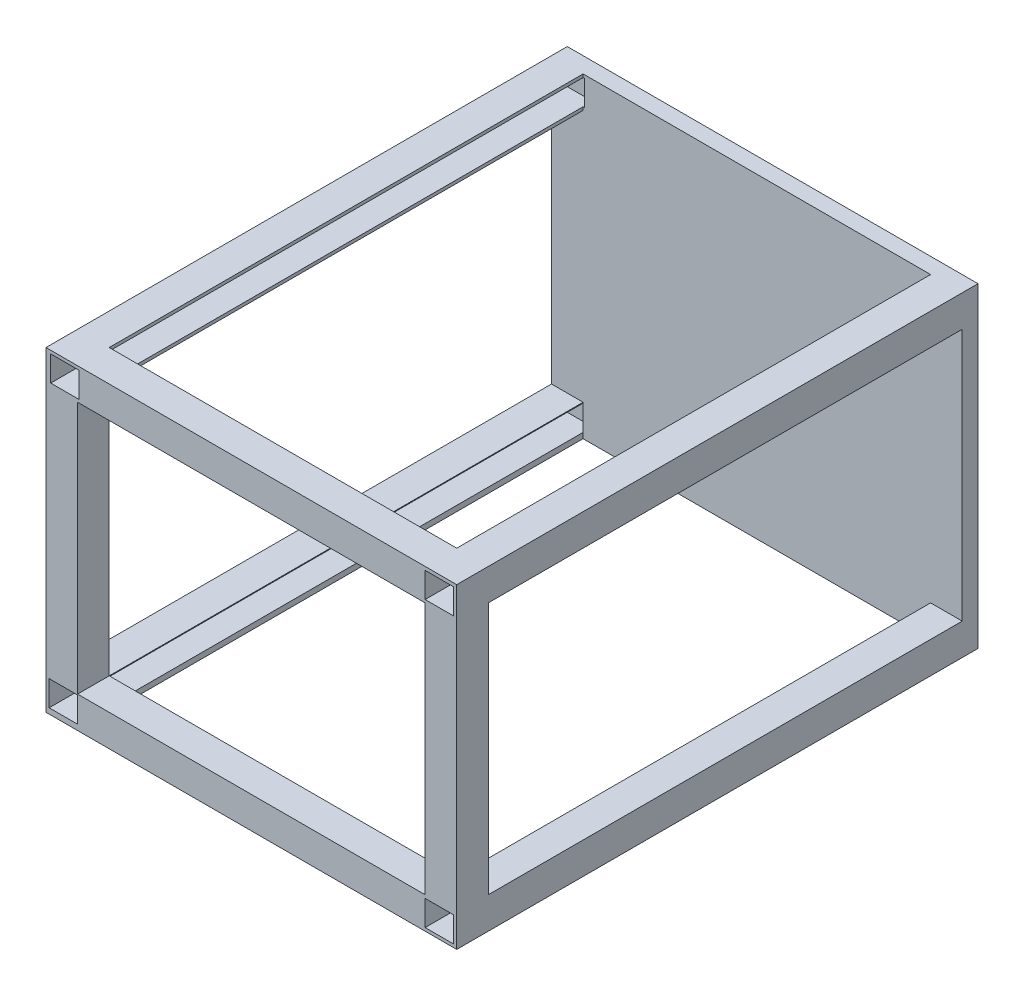
from build123d import *

# Parameters (mm, degrees)
SKETCH1_W           = 130
SKETCH1_H           = 100
BOSS_EXTRUDE1_DEPTH = 5
SKETCH2_W           = 10
SKETCH2_H           = 10
BOSS_EXTRUDE2_DEPTH = 160
SKETCH3_W           = 10
SKETCH3_H           = 10
BOSS_EXTRUDE3_DEPTH = 110
SKETCH4_W           = 10
SKETCH4_H           = 10
BOSS_EXTRUDE4_DEPTH = 110
SKETCH5_W           = 10
SKETCH5_H           = 10
BOSS_EXTRUDE5_DEPTH = 80
SKETCH6_W           = 10
SKETCH6_H           = 10
BOSS_EXTRUDE6_DEPTH = 80
SKETCH9_W           = 9
SKETCH9_H           = 8
CUT_EXTRUDE4_DEPTH  = 163


with BuildPart() as part:
    # Sketch1 → Boss-Extrude1 (new body)
    with BuildSketch(Plane.XY):
        with Locations((65, 50)):
            Rectangle(SKETCH1_W, SKETCH1_H)
    extrude(amount=BOSS_EXTRUDE1_DEPTH)

    # Sketch2 → Boss-Extrude2 (add)
    with BuildSketch(Plane.XY.offset(5)):
        with Locations((5, 95)):
            Rectangle(SKETCH2_W, SKETCH2_H)
        with Locations((125, 95)):
            Rectangle(SKETCH2_W, SKETCH2_H)
        with Locations((5, 5)):
            Rectangle(SKETCH2_W, SKETCH2_H)
        with Locations((125, 5)):
            Rectangle(SKETCH2_W, SKETCH2_H)
    extrude(amount=BOSS_EXTRUDE2_DEPTH)

    # Sketch3 → Boss-Extrude3 (add)
    with BuildSketch(Plane(origin=(10, 0, 0), x_dir=(0, 0, -1), z_dir=(1, 0, 0))):
        with Locations((-160, 5)):
            Rectangle(SKETCH3_W, SKETCH3_H)
    extrude(amount=BOSS_EXTRUDE3_DEPTH)

    # Sketch4 → Boss-Extrude4 (add)
    with BuildSketch(Plane(origin=(10, 0, 0), x_dir=(0, 0, -1), z_dir=(1, 0, 0))):
        with Locations((-160, 95)):
            Rectangle(SKETCH4_W, SKETCH4_H)
    extrude(amount=BOSS_EXTRUDE4_DEPTH)

    # Sketch5 → Boss-Extrude5 (add)
    with BuildSketch(Plane.XZ.offset(-90)):
        with Locations((5, 160)):
            Rectangle(SKETCH5_W, SKETCH5_H)
    extrude(amount=BOSS_EXTRUDE5_DEPTH)

    # Sketch6 → Boss-Extrude6 (add)
    with BuildSketch(Plane.XZ.offset(-90)):
        with Locations((125, 160)):
            Rectangle(SKETCH6_W, SKETCH6_H)
    extrude(amount=BOSS_EXTRUDE6_DEPTH)

    # Sketch9 → Cut-Extrude4 (cut)
    with BuildSketch(Plane.XY.offset(165)):
        with Locations((124.5, 94.920029207)):
            Rectangle(SKETCH9_W, SKETCH9_H)
        with Locations((124.5, 5)):
            Rectangle(SKETCH9_W, SKETCH9_H)
        with Locations((5.5, 5.741486023)):
            Rectangle(SKETCH9_W, SKETCH9_H)
        with Locations((5.995524186, 95)):
            Rectangle(SKETCH9_W, SKETCH9_H)
    extrude(amount=-CUT_EXTRUDE4_DEPTH, mode=Mode.SUBTRACT)


solid = part.part
